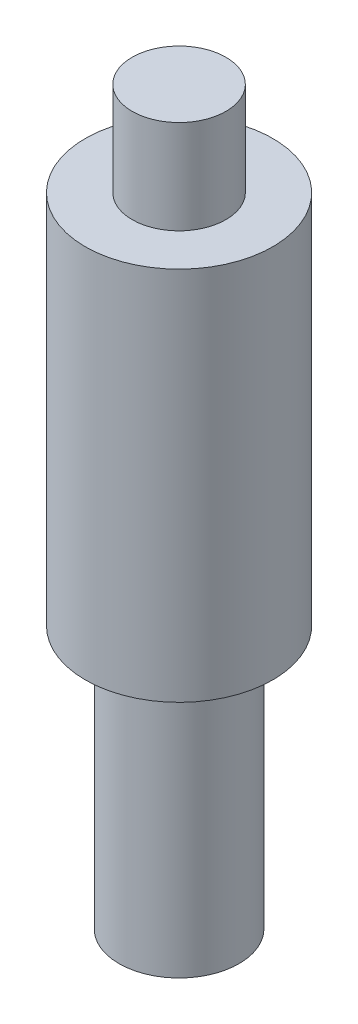
from build123d import *

# Parameters (mm, degrees)
SKETCH_1_R      = 1.6
EXTRUDE_1_DEPTH = 7
SKETCH_2_R      = 2.5
EXTRUDE_2_DEPTH = 10
SKETCH_3_R      = 1.25
EXTRUDE_3_DEPTH = 2.5


with BuildPart() as part:
    # 草图1 → 凸台-拉伸1 (new body)
    with BuildSketch(Plane(origin=(0, 0, 0), x_dir=(1, 0, 0), z_dir=(0, 1, 0))):
        with Locations(Location((0, 0, 0), (0, 0, 270))):
            Circle(SKETCH_1_R)
    extrude(amount=EXTRUDE_1_DEPTH)

    # 草图2 → 凸台-拉伸2 (add)
    with BuildSketch(Plane(origin=(0, 7, 0), x_dir=(1, 0, 0), z_dir=(0, 1, 0))):
        with Locations(Location((0, 0, 0), (0, 0, 270))):
            Circle(SKETCH_2_R)
    extrude(amount=EXTRUDE_2_DEPTH)

    # 草图3 → 凸台-拉伸3 (add)
    with BuildSketch(Plane(origin=(0, 17, 0), x_dir=(1, 0, 0), z_dir=(0, 1, 0))):
        with Locations(Location((0, 0, 0), (0, 0, 270))):
            Circle(SKETCH_3_R)
    extrude(amount=EXTRUDE_3_DEPTH)


solid = part.part
